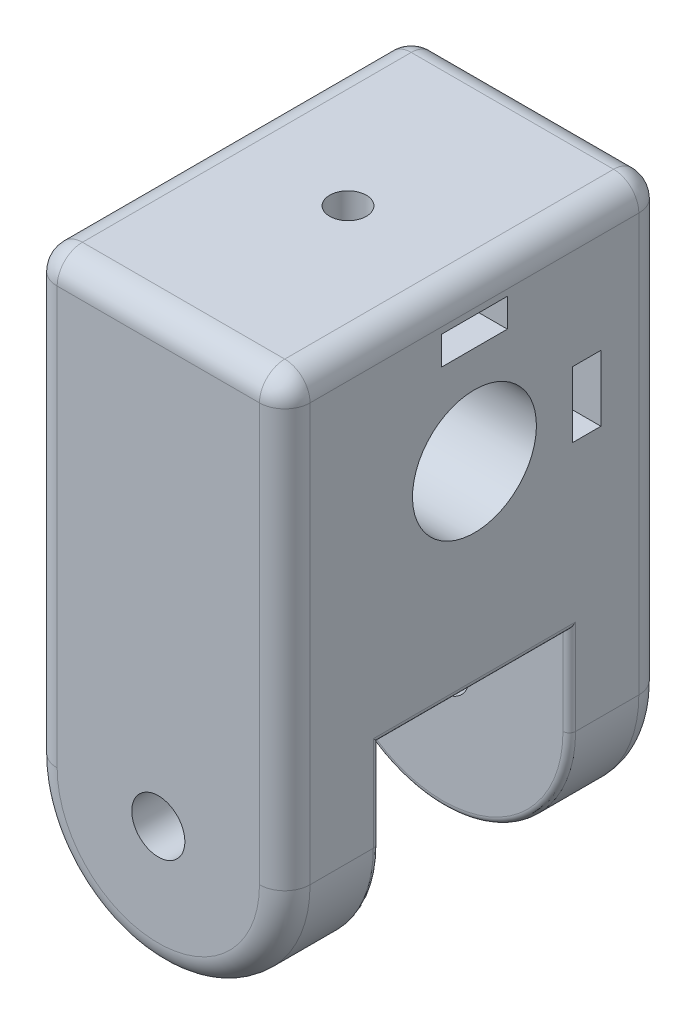
from build123d import *

# Parameters (mm, degrees)
ESQUISSE1_R                  = 2.1
BOSS_EXTRU_1_DEPTH           = 30
ENL_V_MAT_EXTRU_1_DEPTH      = 7.5
ENL_V_MAT_EXTRU_1_DEPTH_BACK = 7.5
ENL_V_MAT_EXTRU_2_REACH      = 47.346
ESQUISSE3_R                  = 4.9
ESQUISSE5_W                  = 2.25
ESQUISSE5_H                  = 5.2
ENL_V_MAT_EXTRU_3_DEPTH      = 15
R_P_TITION_CIRCULAIRE1_COUNT = 2
R_P_TITION_CIRCULAIRE1_ANGLE = 90
CONG_1_R                     = 2
CONG_2_R                     = 0.5


with BuildPart() as part:
    # Esquisse1 → Boss.-Extru.1 (new body)
    with BuildSketch(Plane.XY):
        with BuildLine():
            Line((-10, 17.5), (10, 17.5))
            Line((10, 17.5), (10, -17.5))
            ThreePointArc((10, -17.5), (0, -27.5), (-10, -17.5))
            Line((-10, -17.5), (-10, 17.5))
        make_face()
        with Locations((0, -17.5)):
            Circle(ESQUISSE1_R, mode=Mode.SUBTRACT)
    extrude(amount=BOSS_EXTRU_1_DEPTH)

    # Esquisse2 → Enlèv. mat.-Extru.1 (cut, two sides: drawn at the far end of the back side and taken through both)
    with BuildSketch(Plane.XY.offset(15).offset(-ENL_V_MAT_EXTRU_1_DEPTH_BACK)):
        with BuildLine():
            Line((-7.55579248, -10.5), (-10, -10.5))
            Line((-10, -10.5), (-10, -17.5))
            ThreePointArc((-10, -17.5), (0, -27.5), (10, -17.5))
            Line((10, -17.5), (10, -10.5))
            Line((10, -10.5), (7.55579248, -10.5))
            ThreePointArc((7.55579248, -10.5), (0, -7.2), (-7.55579248, -10.5))
        make_face()
    extrude(amount=ENL_V_MAT_EXTRU_1_DEPTH + ENL_V_MAT_EXTRU_1_DEPTH_BACK, mode=Mode.SUBTRACT)

    # Esquisse3 → Enlèv. mat.-Extru.2 (cut, up to next)
    with BuildSketch(Plane(origin=(10, 0, 0), x_dir=(0, 0, -1), z_dir=(1, 0, 0)), mode=Mode.PRIVATE) as enl_v_mat_extru_2_sk1:
        with Locations(Location((-15, 5, 0), (0, 0, 90))):
            Circle(ESQUISSE3_R)
    enl_v_mat_extru_2_tool1 = extrude(enl_v_mat_extru_2_sk1.sketch, amount=-ENL_V_MAT_EXTRU_2_REACH, mode=Mode.PRIVATE) & part.part
    add(enl_v_mat_extru_2_tool1.solids().sort_by_distance((10, 5, 15))[0], mode=Mode.SUBTRACT)

    # Esquisse5 → Enlèv. mat.-Extru.3 (cut)
    with BuildSketch(Plane(origin=(10, -72.478135826, -1.639734987), x_dir=(0, 0, -1), z_dir=(1, 0, 0))):
        with Locations((-7.764734987, 77.478135826)):
            Rectangle(ESQUISSE5_W, ESQUISSE5_H)
    enl_v_mat_extru_3 = extrude(amount=-ENL_V_MAT_EXTRU_3_DEPTH, mode=Mode.SUBTRACT)

    # Esquisse11 → Dégagement M2.52 (revolve, cut)
    with BuildSketch(Plane(origin=(0, 5, 0), x_dir=(0, 1, 0), z_dir=(1, 0, 0))):
        Polygon((0, 0), (0, 15.870247898), (1.45, 14.999), (1.45, 0), align=None)
    d_gagement_m2_52 = revolve(axis=Axis((0, 5, -6.35), (0, 0, 1)), mode=Mode.SUBTRACT)

    # Répétition circulaire1: Enlèv. mat.-Extru.3, Dégagement M2.52 ×2 about axis
    r_p_tition_circulaire1_axis = Axis((0, 5, 15), (1, 0, 0))
    add([enl_v_mat_extru_3.rotate(r_p_tition_circulaire1_axis, i * R_P_TITION_CIRCULAIRE1_ANGLE / (R_P_TITION_CIRCULAIRE1_COUNT - 1)) for i in range(1, R_P_TITION_CIRCULAIRE1_COUNT)], mode=Mode.SUBTRACT)
    add([d_gagement_m2_52.rotate(r_p_tition_circulaire1_axis, i * R_P_TITION_CIRCULAIRE1_ANGLE / (R_P_TITION_CIRCULAIRE1_COUNT - 1)) for i in range(1, R_P_TITION_CIRCULAIRE1_COUNT)], mode=Mode.SUBTRACT)

    # Congé1
    cong_1_edges = [part.edges().sort_by_distance(p)[0] for p in [
        (10, 0, 30),
        (-10, 17.5, 15),
        (10, 17.5, 15),
        (0, 17.5, 30),
        (-10, 0, 30),
        (0, -27.5, 30),
        (-10, 0, 0),
        (0, 17.5, 0),
        (10, 0, 0),
        (0, -27.5, 0),
    ]]
    fillet(cong_1_edges, radius=CONG_1_R)

    # Congé2
    cong_2_edges = [part.edges().sort_by_distance(p)[0] for p in [
        (7.55579248, -10.5, 15),
        (-7.55579248, -10.5, 15),
        (-10, -10.5, 15),
        (-10, -14, 7.5),
        (0, -27.5, 7.5),
        (10, -14, 7.5),
        (10, -10.5, 15),
        (-10, -14, 22.5),
        (0, -27.5, 22.5),
        (10, -14, 22.5),
    ]]
    fillet(cong_2_edges, radius=CONG_2_R)


solid = part.part
